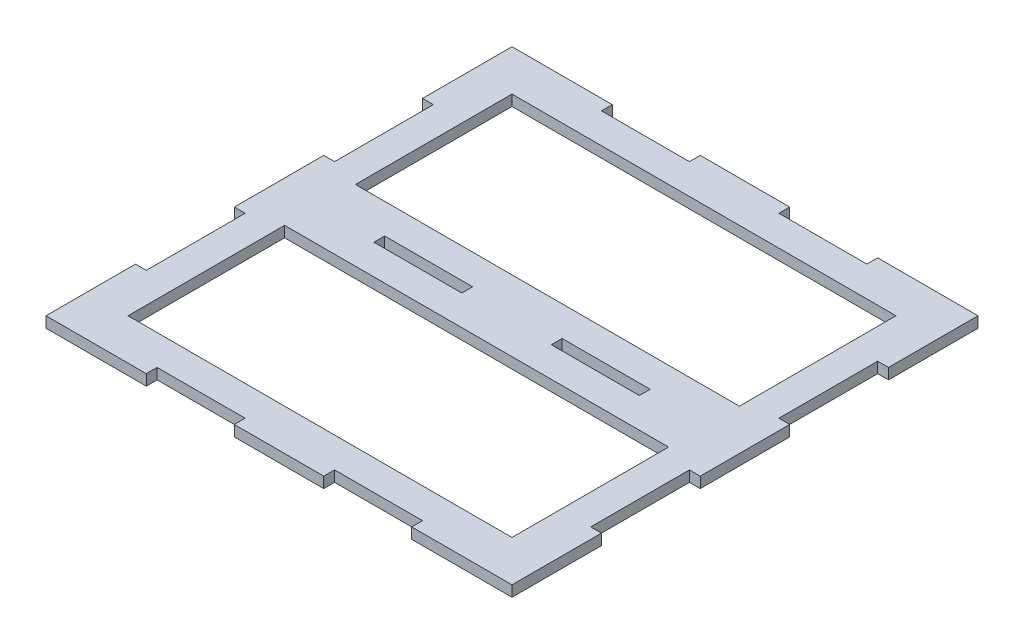
from build123d import *

# Parameters (mm, degrees)
SKETCH_1_W          = 250
SKETCH_1_H          = 250
SKETCH_1_W_2        = 206
SKETCH_1_H_2        = 84
EXTRUDE_1_DEPTH     = 5.8
CUT_EXTRUDE_1_REACH = 355.601
SKETCH_2_W          = 47.2
SKETCH_2_H          = 5.8
SKETCH_2_W_2        = 5.8
SKETCH_2_H_2        = 53


with BuildPart() as part:
    # Эскиз1 → Бобышка-Вытянуть1 (new body)
    with BuildSketch(Plane(origin=(0, 0, 0), x_dir=(1, 0, 0), z_dir=(0, 1, 0))):
        with Locations((125, 125)):
            Rectangle(SKETCH_1_W, SKETCH_1_H)
        with Locations((125, 186)):
            Rectangle(SKETCH_1_W_2, SKETCH_1_H_2, mode=Mode.SUBTRACT)
        with Locations((125, 64)):
            Rectangle(SKETCH_1_W_2, SKETCH_1_H_2, mode=Mode.SUBTRACT)
    extrude(amount=EXTRUDE_1_DEPTH)

    # Эскиз2 → Вырез-Вытянуть1 (cut, up to next)
    with BuildSketch(Plane(origin=(0, 5.8, 0), x_dir=(1, 0, 0), z_dir=(0, 1, 0)), mode=Mode.PRIVATE) as cut_extrude_1_sk1:
        with Locations((77.4, 2.9)):
            Rectangle(SKETCH_2_W, SKETCH_2_H)
    cut_extrude_1_tool1 = extrude(cut_extrude_1_sk1.sketch, amount=-CUT_EXTRUDE_1_REACH, mode=Mode.PRIVATE) & part.part
    # Эскиз2 → Вырез-Вытянуть1 (cut, up to next)
    with BuildSketch(Plane(origin=(0, 5.8, 0), x_dir=(1, 0, 0), z_dir=(0, 1, 0)), mode=Mode.PRIVATE) as cut_extrude_1_sk2:
        with Locations((77.4, 125)):
            Rectangle(SKETCH_2_W, SKETCH_2_H)
    cut_extrude_1_tool2 = extrude(cut_extrude_1_sk2.sketch, amount=-CUT_EXTRUDE_1_REACH, mode=Mode.PRIVATE) & part.part
    # Эскиз2 → Вырез-Вытянуть1 (cut, up to next)
    with BuildSketch(Plane(origin=(0, 5.8, 0), x_dir=(1, 0, 0), z_dir=(0, 1, 0)), mode=Mode.PRIVATE) as cut_extrude_1_sk3:
        with Locations((77.4, 247.1)):
            Rectangle(SKETCH_2_W, SKETCH_2_H)
    cut_extrude_1_tool3 = extrude(cut_extrude_1_sk3.sketch, amount=-CUT_EXTRUDE_1_REACH, mode=Mode.PRIVATE) & part.part
    # Эскиз2 → Вырез-Вытянуть1 (cut, up to next)
    with BuildSketch(Plane(origin=(0, 5.8, 0), x_dir=(1, 0, 0), z_dir=(0, 1, 0)), mode=Mode.PRIVATE) as cut_extrude_1_sk4:
        with Locations((2.9, 175.5)):
            Rectangle(SKETCH_2_W_2, SKETCH_2_H_2)
    cut_extrude_1_tool4 = extrude(cut_extrude_1_sk4.sketch, amount=-CUT_EXTRUDE_1_REACH, mode=Mode.PRIVATE) & part.part
    # Эскиз2 → Вырез-Вытянуть1 (cut, up to next)
    with BuildSketch(Plane(origin=(0, 5.8, 0), x_dir=(1, 0, 0), z_dir=(0, 1, 0)), mode=Mode.PRIVATE) as cut_extrude_1_sk5:
        with Locations((2.9, 74.5)):
            Rectangle(SKETCH_2_W_2, SKETCH_2_H_2)
    cut_extrude_1_tool5 = extrude(cut_extrude_1_sk5.sketch, amount=-CUT_EXTRUDE_1_REACH, mode=Mode.PRIVATE) & part.part
    # Эскиз2 → Вырез-Вытянуть1 (cut, up to next)
    with BuildSketch(Plane(origin=(0, 5.8, 0), x_dir=(1, 0, 0), z_dir=(0, 1, 0)), mode=Mode.PRIVATE) as cut_extrude_1_sk6:
        with Locations((172.6, 2.9)):
            Rectangle(SKETCH_2_W, SKETCH_2_H)
    cut_extrude_1_tool6 = extrude(cut_extrude_1_sk6.sketch, amount=-CUT_EXTRUDE_1_REACH, mode=Mode.PRIVATE) & part.part
    # Эскиз2 → Вырез-Вытянуть1 (cut, up to next)
    with BuildSketch(Plane(origin=(0, 5.8, 0), x_dir=(1, 0, 0), z_dir=(0, 1, 0)), mode=Mode.PRIVATE) as cut_extrude_1_sk7:
        with Locations((172.6, 125)):
            Rectangle(SKETCH_2_W, SKETCH_2_H)
    cut_extrude_1_tool7 = extrude(cut_extrude_1_sk7.sketch, amount=-CUT_EXTRUDE_1_REACH, mode=Mode.PRIVATE) & part.part
    # Эскиз2 → Вырез-Вытянуть1 (cut, up to next)
    with BuildSketch(Plane(origin=(0, 5.8, 0), x_dir=(1, 0, 0), z_dir=(0, 1, 0)), mode=Mode.PRIVATE) as cut_extrude_1_sk8:
        with Locations((172.6, 247.1)):
            Rectangle(SKETCH_2_W, SKETCH_2_H)
    cut_extrude_1_tool8 = extrude(cut_extrude_1_sk8.sketch, amount=-CUT_EXTRUDE_1_REACH, mode=Mode.PRIVATE) & part.part
    # Эскиз2 → Вырез-Вытянуть1 (cut, up to next)
    with BuildSketch(Plane(origin=(0, 5.8, 0), x_dir=(1, 0, 0), z_dir=(0, 1, 0)), mode=Mode.PRIVATE) as cut_extrude_1_sk9:
        with Locations((247.1, 175.5)):
            Rectangle(SKETCH_2_W_2, SKETCH_2_H_2)
    cut_extrude_1_tool9 = extrude(cut_extrude_1_sk9.sketch, amount=-CUT_EXTRUDE_1_REACH, mode=Mode.PRIVATE) & part.part
    # Эскиз2 → Вырез-Вытянуть1 (cut, up to next)
    with BuildSketch(Plane(origin=(0, 5.8, 0), x_dir=(1, 0, 0), z_dir=(0, 1, 0)), mode=Mode.PRIVATE) as cut_extrude_1_sk10:
        with Locations((247.1, 74.5)):
            Rectangle(SKETCH_2_W_2, SKETCH_2_H_2)
    cut_extrude_1_tool10 = extrude(cut_extrude_1_sk10.sketch, amount=-CUT_EXTRUDE_1_REACH, mode=Mode.PRIVATE) & part.part
    add(cut_extrude_1_tool1.solids().sort_by_distance((77.4, 5.8, -2.9))[0], mode=Mode.SUBTRACT)
    add(cut_extrude_1_tool2.solids().sort_by_distance((77.4, 5.8, -125))[0], mode=Mode.SUBTRACT)
    add(cut_extrude_1_tool3.solids().sort_by_distance((77.4, 5.8, -247.1))[0], mode=Mode.SUBTRACT)
    add(cut_extrude_1_tool4.solids().sort_by_distance((2.9, 5.8, -175.5))[0], mode=Mode.SUBTRACT)
    add(cut_extrude_1_tool5.solids().sort_by_distance((2.9, 5.8, -74.5))[0], mode=Mode.SUBTRACT)
    add(cut_extrude_1_tool6.solids().sort_by_distance((172.6, 5.8, -2.9))[0], mode=Mode.SUBTRACT)
    add(cut_extrude_1_tool7.solids().sort_by_distance((172.6, 5.8, -125))[0], mode=Mode.SUBTRACT)
    add(cut_extrude_1_tool8.solids().sort_by_distance((172.6, 5.8, -247.1))[0], mode=Mode.SUBTRACT)
    add(cut_extrude_1_tool9.solids().sort_by_distance((247.1, 5.8, -175.5))[0], mode=Mode.SUBTRACT)
    add(cut_extrude_1_tool10.solids().sort_by_distance((247.1, 5.8, -74.5))[0], mode=Mode.SUBTRACT)


solid = part.part
